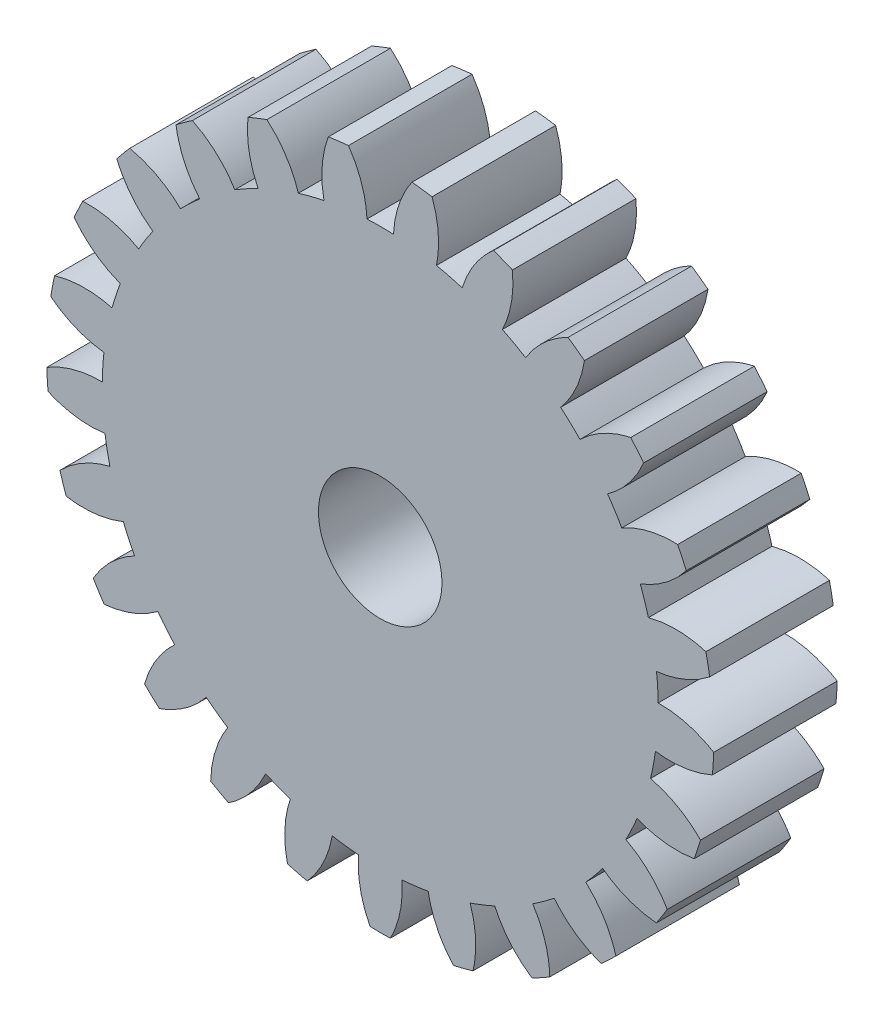
from build123d import *

# Parameters (mm, degrees)
SKETCH1_R           = 27
BOSS_EXTRUDE1_DEPTH = 5
CIRPATTERN1_COUNT   = 25
SKETCH6_R           = 5
CUT_EXTRUDE1_DEPTH  = 40.461778968


with BuildPart() as part:
    # Sketch1 → Boss-Extrude1 (new, symmetric)
    with BuildSketch(Plane.XY):
        Circle(SKETCH1_R)
    extrude(amount=BOSS_EXTRUDE1_DEPTH, both=True)

    # Sketch4 for Cut-Loft1 → Cut-Loft1 section 0
    with BuildSketch(Plane.XY.offset(5)):
        with BuildLine():
            # circular arc as an exact rational Bezier (weights 1, cos(half-angle), 1)
            Bezier((-1.072022538, 22.474446994), (-1.218687107, 25.549200535), (-3.31531694, 27.803033532), weights=[1, 0.939095418, 1])
            Bezier((-3.31531694, 27.803033532), (0, 28.198361848), (3.31531694, 27.803033532), weights=[1, 0.992965483, 1])
            Bezier((3.31531694, 27.803033532), (1.218687107, 25.549200535), (1.072022538, 22.474446994), weights=[1, 0.939095418, 1])
            Bezier((1.072022538, 22.474446994), (0, 22.525582059), (-1.072022538, 22.474446994), weights=[1, 0.998864311, 1])
        make_face()
    # Sketch3 for Cut-Loft1 → Cut-Loft1 section 1
    with BuildSketch(Plane.XY):
        with BuildLine():
            Bezier((-1.072022538, 22.474446994), (-1.218687107, 25.549200535), (-3.31531694, 27.803033532), weights=[1, 0.939095418, 1])
            Bezier((-3.31531694, 27.803033532), (0, 28.198361848), (3.31531694, 27.803033532), weights=[1, 0.992965483, 1])
            Bezier((3.31531694, 27.803033532), (1.218687107, 25.549200535), (1.072022538, 22.474446994), weights=[1, 0.939095418, 1])
            Bezier((1.072022538, 22.474446994), (0, 22.525582059), (-1.072022538, 22.474446994), weights=[1, 0.998864311, 1])
        make_face()
    # Sketch5 for Cut-Loft1 → Cut-Loft1 section 2
    with BuildSketch(Plane.XY.offset(-5)):
        with BuildLine():
            Bezier((-1.072022538, 22.474446994), (-1.218687107, 25.549200535), (-3.31531694, 27.803033532), weights=[1, 0.939095418, 1])
            Bezier((-3.31531694, 27.803033532), (0, 28.198361848), (3.31531694, 27.803033532), weights=[1, 0.992965483, 1])
            Bezier((3.31531694, 27.803033532), (1.218687107, 25.549200535), (1.072022538, 22.474446994), weights=[1, 0.939095418, 1])
            Bezier((1.072022538, 22.474446994), (0, 22.525582059), (-1.072022538, 22.474446994), weights=[1, 0.998864311, 1])
        make_face()
    cut_loft1 = loft(mode=Mode.SUBTRACT)

    # CirPattern1: Cut-Loft1 ×25 about axis
    cirpattern1_axis = Axis((0, 0, 5), (0, 0, -1))
    for i in range(1, CIRPATTERN1_COUNT):
        add(cut_loft1.rotate(cirpattern1_axis, i * 360 / CIRPATTERN1_COUNT), mode=Mode.SUBTRACT)

    # Sketch6 → Cut-Extrude1 (cut, through all)
    with BuildSketch(Plane.XY.offset(5)):
        Circle(SKETCH6_R)
    extrude(amount=-CUT_EXTRUDE1_DEPTH, mode=Mode.SUBTRACT)


solid = part.part
